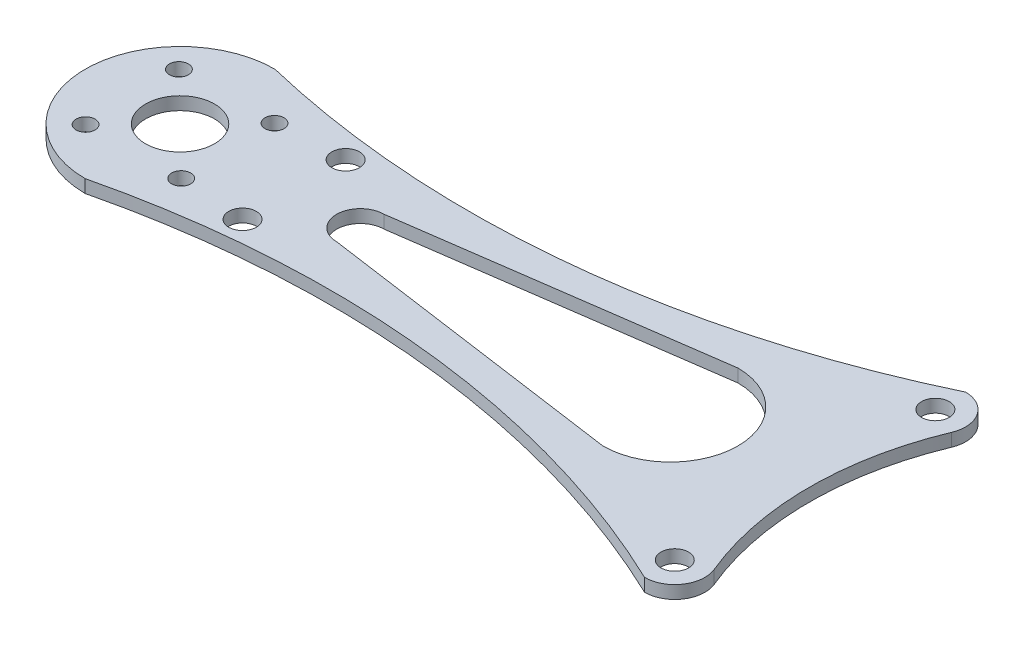
from build123d import *

# Parameters (mm, degrees)
ESBO_O1_R                = 1.6
RESSALTO_EXTRUS_O1_DEPTH = 0.75
CORTE_EXTRUS_O1_REACH    = 123.445
ESBO_O2_R                = 4
ESBO_O2_R_2              = 1.1


with BuildPart() as part:
    # Esboço1 → Ressalto-extrusão1 (new, symmetric)
    with BuildSketch(Plane(origin=(0, 0, 0), x_dir=(1, 0, 0), z_dir=(0, 1, 0))):
        with BuildLine():
            ThreePointArc((-33.25966317, 13.776603565), (-36, 0), (-33.25966317, -13.776603565))
            ThreePointArc((-33.25966317, -13.776603565), (-33.583097891, -17.060491394), (-36.493241534, -18.615995578))
            ThreePointArc((-36.493241534, -18.615995578), (-72.090991916, -8.566197582), (-109, -11))
            ThreePointArc((-109, -11), (-120, 0), (-109, 11))
            ThreePointArc((-109, 11), (-72.090991916, 8.566197582), (-36.493241534, 18.615995578))
            ThreePointArc((-36.493241534, 18.615995578), (-33.583097891, 17.060491394), (-33.25966317, 13.776603565))
        make_face()
        with Locations(Location((-36.493241534, 15.115995578, 0), (0, 0, 270))):
            Circle(ESBO_O1_R, mode=Mode.SUBTRACT)
        with Locations(Location((-36.493241534, -15.115995578, 0), (0, 0, 270))):
            Circle(ESBO_O1_R, mode=Mode.SUBTRACT)
        with Locations(Location((-95.79, 6, 0), (0, 0, 270))):
            Circle(ESBO_O1_R, mode=Mode.SUBTRACT)
        with Locations(Location((-95.79, -5.96, 0), (0, 0, 270))):
            Circle(ESBO_O1_R, mode=Mode.SUBTRACT)
    extrude(amount=RESSALTO_EXTRUS_O1_DEPTH, both=True)

    # Esboço2 → Corte-extrusão1 (cut, up to next)
    with BuildSketch(Plane(origin=(0, 0.75, 0), x_dir=(1, 0, 0), z_dir=(0, 1, 0)), mode=Mode.PRIVATE) as corte_extrus_o1_sk1:
        with Locations(Location((-109, 0, 0), (0, 0, 270))):
            Circle(ESBO_O2_R)
    corte_extrus_o1_tool1 = extrude(corte_extrus_o1_sk1.sketch, amount=-CORTE_EXTRUS_O1_REACH, mode=Mode.PRIVATE) & part.part
    # Esboço2 → Corte-extrusão1 (cut, up to next)
    with BuildSketch(Plane(origin=(0, 0.75, 0), x_dir=(1, 0, 0), z_dir=(0, 1, 0)), mode=Mode.PRIVATE) as corte_extrus_o1_sk2:
        with Locations(Location((-103.586557067, 5.545911613, 0), (0, 0, 270))):
            Circle(ESBO_O2_R_2)
    corte_extrus_o1_tool2 = extrude(corte_extrus_o1_sk2.sketch, amount=-CORTE_EXTRUS_O1_REACH, mode=Mode.PRIVATE) & part.part
    # Esboço2 → Corte-extrusão1 (cut, up to next)
    with BuildSketch(Plane(origin=(0, 0.75, 0), x_dir=(1, 0, 0), z_dir=(0, 1, 0)), mode=Mode.PRIVATE) as corte_extrus_o1_sk3:
        with Locations(Location((-103.454088387, -5.413442933, 0), (0, 0, 270))):
            Circle(ESBO_O2_R_2)
    corte_extrus_o1_tool3 = extrude(corte_extrus_o1_sk3.sketch, amount=-CORTE_EXTRUS_O1_REACH, mode=Mode.PRIVATE) & part.part
    # Esboço2 → Corte-extrusão1 (cut, up to next)
    with BuildSketch(Plane(origin=(0, 0.75, 0), x_dir=(1, 0, 0), z_dir=(0, 1, 0)), mode=Mode.PRIVATE) as corte_extrus_o1_sk4:
        with Locations(Location((-114.413442933, -5.545911613, 0), (0, 0, 270))):
            Circle(ESBO_O2_R_2)
    corte_extrus_o1_tool4 = extrude(corte_extrus_o1_sk4.sketch, amount=-CORTE_EXTRUS_O1_REACH, mode=Mode.PRIVATE) & part.part
    # Esboço2 → Corte-extrusão1 (cut, up to next)
    with BuildSketch(Plane(origin=(0, 0.75, 0), x_dir=(1, 0, 0), z_dir=(0, 1, 0)), mode=Mode.PRIVATE) as corte_extrus_o1_sk5:
        with Locations(Location((-114.545911613, 5.413442933, 0), (0, 0, 270))):
            Circle(ESBO_O2_R_2)
    corte_extrus_o1_tool5 = extrude(corte_extrus_o1_sk5.sketch, amount=-CORTE_EXTRUS_O1_REACH, mode=Mode.PRIVATE) & part.part
    # Esboço2 → Corte-extrusão1 (cut, up to next)
    with BuildSketch(Plane(origin=(0, 0.75, 0), x_dir=(1, 0, 0), z_dir=(0, 1, 0)), mode=Mode.PRIVATE) as corte_extrus_o1_sk6:
        with BuildLine():
            Line((-88.078445949, 2.757577424), (-52.119636338, 7.831519885))
            ThreePointArc((-52.119636338, 7.831519885), (-44.288116453, 0), (-52.119636338, -7.831519885))
            Line((-52.119636338, -7.831519885), (-88.078445949, -2.757577424))
            ThreePointArc((-88.078445949, -2.757577424), (-90.836023373, 0), (-88.078445949, 2.757577424))
        make_face()
    corte_extrus_o1_tool6 = extrude(corte_extrus_o1_sk6.sketch, amount=-CORTE_EXTRUS_O1_REACH, mode=Mode.PRIVATE) & part.part
    add(corte_extrus_o1_tool1.solids().sort_by_distance((-109, 0.75, 0))[0], mode=Mode.SUBTRACT)
    add(corte_extrus_o1_tool2.solids().sort_by_distance((-103.586557, 0.75, -5.545912))[0], mode=Mode.SUBTRACT)
    add(corte_extrus_o1_tool3.solids().sort_by_distance((-103.454088, 0.75, 5.413443))[0], mode=Mode.SUBTRACT)
    add(corte_extrus_o1_tool4.solids().sort_by_distance((-114.413443, 0.75, 5.545912))[0], mode=Mode.SUBTRACT)
    add(corte_extrus_o1_tool5.solids().sort_by_distance((-114.545912, 0.75, -5.413443))[0], mode=Mode.SUBTRACT)
    add(corte_extrus_o1_tool6.solids().sort_by_distance((-64.134293, 0.75, 0))[0], mode=Mode.SUBTRACT)


solid = part.part
